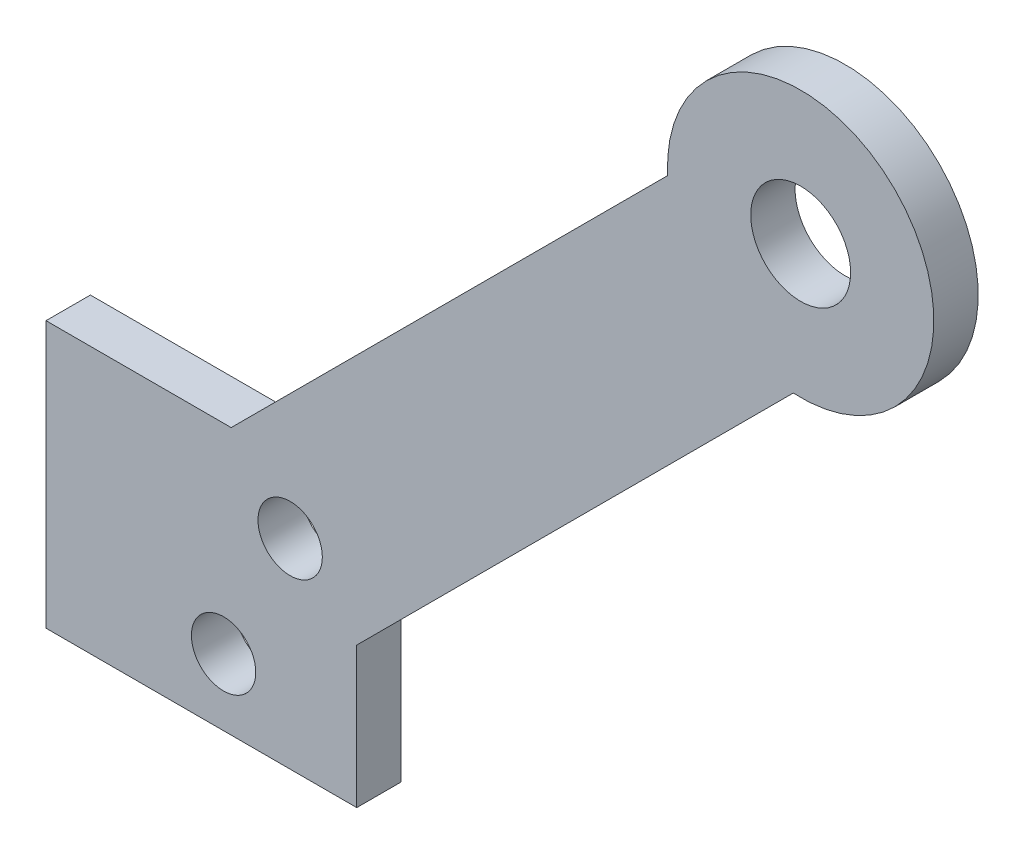
from build123d import *

# Parameters (mm, degrees)
SKETCH1_R                         = 6
SKETCH1_R_2                       = 2.25
FOLLOWER_SEAT_D4P5_DEPTH          = 2
CARRIAGE_TO_FOLLOWER_BRIDGE_DEPTH = 2
SKETCH3_W                         = 14
SKETCH3_H                         = 12
CARRIAGE_ATTACHMENT_PAD_DEPTH     = 2
SKETCH5_R                         = 1.45
STOP_MOUNT_D2P9_THROUGH_DEPTH     = 2.01


with BuildPart() as part:
    # Sketch1 → Follower_Seat_D4p5 (new body)
    with BuildSketch(Plane.XY):
        with Locations((50, 50)):
            Circle(SKETCH1_R)
        with Locations((50, 50)):
            Circle(SKETCH1_R_2, mode=Mode.SUBTRACT)
    extrude(amount=FOLLOWER_SEAT_D4P5_DEPTH)

    # Sketch2 → Carriage_To_Follower_Bridge (add)
    with BuildSketch(Plane.XY):
        Polygon((21.171572875, 26.828427125), (44.171572875, 49.828427125), (49.828427125, 44.171572875), (26.828427125, 21.171572875), align=None)
    extrude(amount=CARRIAGE_TO_FOLLOWER_BRIDGE_DEPTH)

    # Sketch3 → Carriage_Attachment_Pad (add)
    with BuildSketch(Plane.XY):
        with Locations((23, 24)):
            Rectangle(SKETCH3_W, SKETCH3_H)
    extrude(amount=CARRIAGE_ATTACHMENT_PAD_DEPTH)

    # Sketch5 → Stop_Mount_D2p9_Through (cut)
    with BuildSketch(Plane.XY.offset(2)):
        with Locations((24, 21)):
            Circle(SKETCH5_R)
        with Locations((27, 27)):
            Circle(SKETCH5_R)
    extrude(amount=-STOP_MOUNT_D2P9_THROUGH_DEPTH, mode=Mode.SUBTRACT)


solid = part.part
